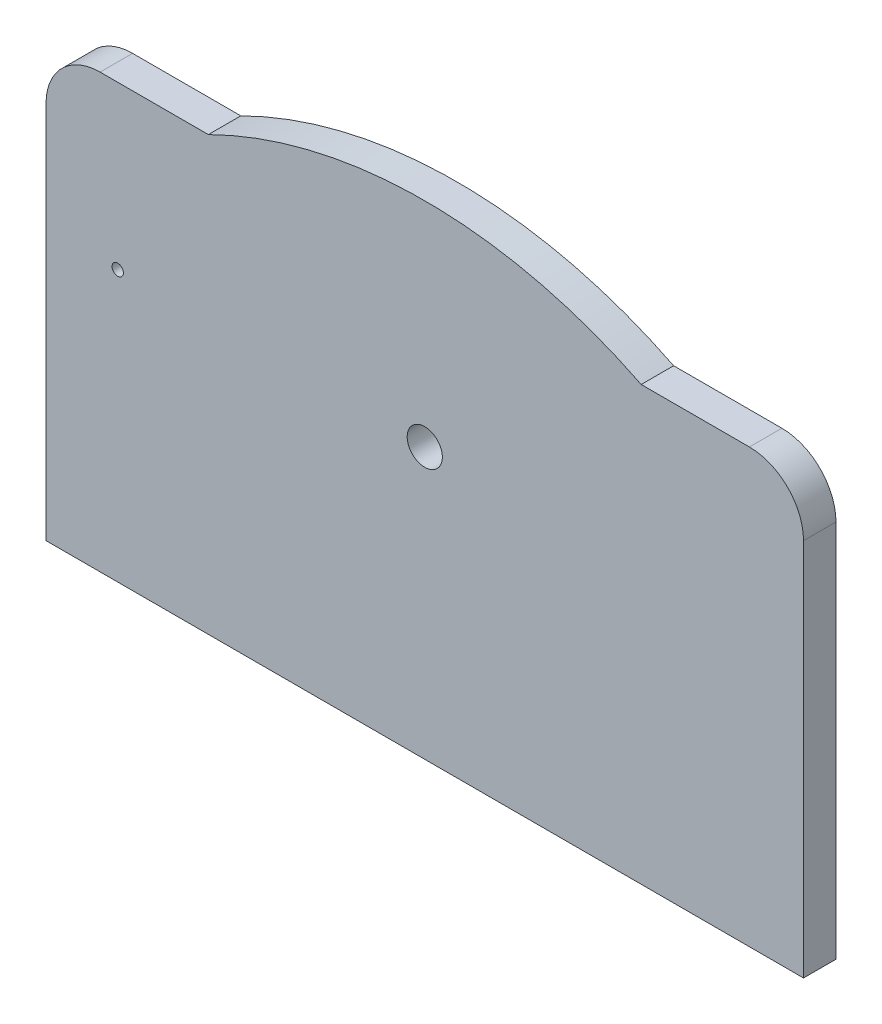
from build123d import *

# Parameters (mm, degrees)
ESQUISSE1_W             = 140
ESQUISSE1_H             = 80
EXTRUSION1_DEPTH        = 6
CONG_1_R                = 10
ESQUISSE2_R             = 3.25
ENL_V_MAT_EXTRU_1_DEPTH = 90.643739324
ESQUISSE5_R             = 1.05
ENL_V_MAT_EXTRU_2_DEPTH = 1
EXTRUSION2_DEPTH        = 6
ESQUISSE7_R             = 1.05
ENL_V_MAT_EXTRU_3_DEPTH = 95.223768892


with BuildPart() as part:
    # Esquisse1 → Extrusion1 (new body)
    with BuildSketch(Plane.XY):
        with Locations((10, 0)):
            Rectangle(ESQUISSE1_W, ESQUISSE1_H)
    extrude(amount=EXTRUSION1_DEPTH)

    # Congé1
    cong_1_edges = [part.edges().sort_by_distance(p)[0] for p in [
        (-60, 40, 3),
        (80, 40, 3),
    ]]
    fillet(cong_1_edges, radius=CONG_1_R)

    # Esquisse2 → Enlèv. mat.-Extru.1 (cut, through all)
    with BuildSketch(Plane.XY.offset(6)):
        with Locations((10, 10)):
            Circle(ESQUISSE2_R)
    extrude(amount=-ENL_V_MAT_EXTRU_1_DEPTH, mode=Mode.SUBTRACT)

    # Esquisse5 → Enlèv. mat.-Extru.2 (cut)
    with BuildSketch(Plane(origin=(0, 0, 0), x_dir=(-1, 0, 0), z_dir=(0, 0, -1))):
        with Locations((19.77, 14.8)):
            Circle(ESQUISSE5_R)
        with Locations((19.77, 5.3)):
            Circle(ESQUISSE5_R)
    extrude(amount=-ENL_V_MAT_EXTRU_2_DEPTH, mode=Mode.SUBTRACT)

    # Esquisse6 → Extrusion2 (add)
    with BuildSketch(Plane(origin=(0, 0, 0), x_dir=(-1, 0, 0), z_dir=(0, 0, -1))):
        with BuildLine():
            Line((-50, 40), (30, 40))
            ThreePointArc((30, 40), (-10, 49.417796635), (-50, 40))
        make_face()
    extrude(amount=-EXTRUSION2_DEPTH)

    # Esquisse7 → Enlèv. mat.-Extru.3 (cut, through all)
    with BuildSketch(Plane(origin=(0, 0, 0), x_dir=(-1, 0, 0), z_dir=(0, 0, -1))):
        with Locations((46.75, 10)):
            Circle(ESQUISSE7_R)
    extrude(amount=-ENL_V_MAT_EXTRU_3_DEPTH, mode=Mode.SUBTRACT)


solid = part.part
